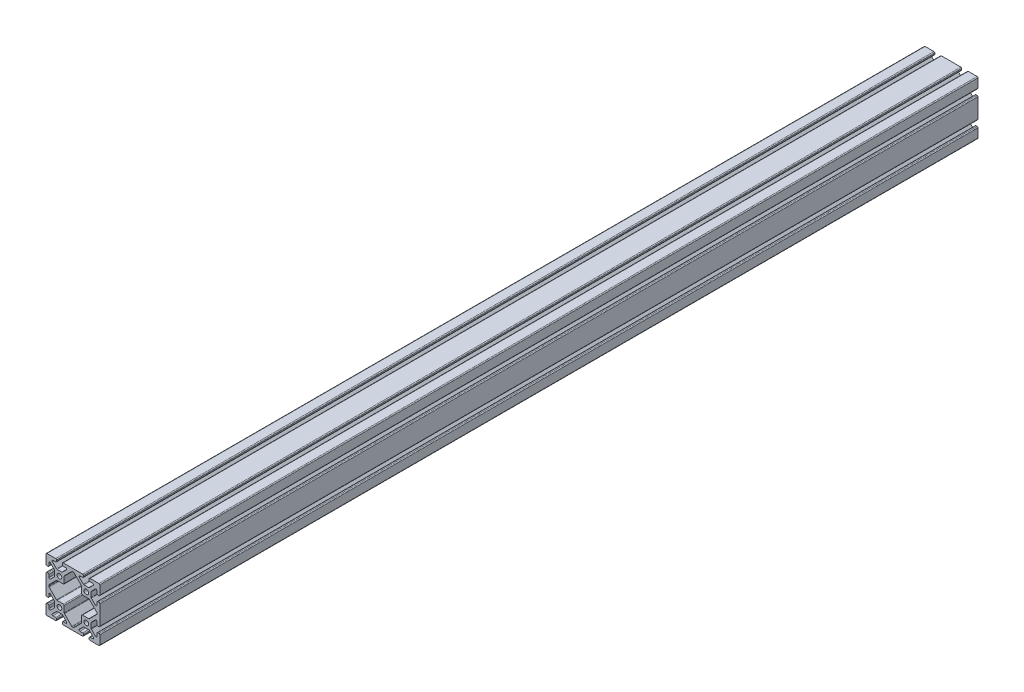
from build123d import *

# Parameters (mm, degrees)
SKETCH1_R           = 3.3274
BOSS_EXTRUDE1_DEPTH = 1244.6
FILLET1_R           = 1.27


with BuildPart() as part:
    # Sketch1 → Boss-Extrude1 (new body)
    with BuildSketch(Plane.XY):
        Polygon((-12.112318041, 14.986), (-3.882718041, 6.7564), (3.882718041, 6.7564), (12.112318041, 14.986), (4.064, 14.986), (4.064, 19.05), (19.05, 19.05), (19.05, 4.064), (14.986, 4.064), (14.986, 12.112318041), (6.7564, 3.882718041), (6.7564, -3.882718041), (14.986, -12.112318041), (14.986, -4.064), (19.05, -4.064), (19.05, -34.036), (14.986, -34.036), (14.986, -25.987681959), (6.7564, -34.217281959), (6.7564, -41.982718041), (14.986, -50.212318041), (14.986, -42.164), (19.05, -42.164), (19.05, -57.15), (4.064, -57.15), (4.064, -53.086), (12.112318041, -53.086), (3.882718041, -44.8564), (-3.882718041, -44.8564), (-12.112318041, -53.086), (-4.064, -53.086), (-4.064, -57.15), (-34.036, -57.15), (-34.036, -53.086), (-25.987681959, -53.086), (-34.217281959, -44.8564), (-41.982718041, -44.8564), (-50.212318041, -53.086), (-42.164, -53.086), (-42.164, -57.15), (-57.15, -57.15), (-57.15, -42.164), (-53.086, -42.164), (-53.086, -50.212318041), (-44.8564, -41.982718041), (-44.8564, -34.217281959), (-53.086, -25.987681959), (-53.086, -34.036), (-57.15, -34.036), (-57.15, -4.064), (-53.086, -4.064), (-53.086, -12.112318041), (-44.8564, -3.882718041), (-44.8564, 3.882718041), (-53.086, 12.112318041), (-53.086, 4.064), (-57.15, 4.064), (-57.15, 19.05), (-42.164, 19.05), (-42.164, 14.986), (-50.212318041, 14.986), (-41.982718041, 6.7564), (-34.217281959, 6.7564), (-25.987681959, 14.986), (-34.036, 14.986), (-34.036, 19.05), (-4.064, 19.05), (-4.064, 14.986), align=None)
        Circle(SKETCH1_R, mode=Mode.SUBTRACT)
        with Locations(Location((0, -38.1, 0), (0, 0, 180))):
            Circle(SKETCH1_R, mode=Mode.SUBTRACT)
        with Locations((-38.1, -38.1)):
            Circle(SKETCH1_R, mode=Mode.SUBTRACT)
        with Locations(Location((-38.1, 0, 0), (0, 0, 180))):
            Circle(SKETCH1_R, mode=Mode.SUBTRACT)
        Polygon((-6.7564, 3.882718041), (-6.7564, -6.7564), (3.882718041, -6.7564), (14.986, -17.859681959), (14.986, -20.240318041), (3.882718041, -31.3436), (-6.7564, -31.3436), (-6.7564, -41.982718041), (-17.859681959, -53.086), (-20.240318041, -53.086), (-31.3436, -41.982718041), (-31.3436, -31.3436), (-41.982718041, -31.3436), (-53.086, -20.240318041), (-53.086, -17.859681959), (-41.982718041, -6.7564), (-31.3436, -6.7564), (-31.3436, 3.882718041), (-20.240318041, 14.986), (-17.859681959, 14.986), align=None, mode=Mode.SUBTRACT)
    extrude(amount=BOSS_EXTRUDE1_DEPTH)

    # Fillet1
    fillet1_edges = [part.edges().sort_by_distance(p)[0] for p in [
        (19.05, 19.05, 622.3),
        (19.05, 4.064, 622.3),
        (14.986, 4.064, 622.3),
        (14.986, 12.112318041, 622.3),
        (6.7564, 3.882718041, 622.3),
        (6.7564, -3.882718041, 622.3),
        (14.986, -12.112318041, 622.3),
        (14.986, -4.064, 622.3),
        (19.05, -4.064, 622.3),
        (19.05, -34.036, 622.3),
        (14.986, -34.036, 622.3),
        (14.986, -25.987681959, 622.3),
        (6.7564, -34.217281959, 622.3),
        (6.7564, -41.982718041, 622.3),
        (14.986, -50.212318041, 622.3),
        (14.986, -42.164, 622.3),
        (19.05, -42.164, 622.3),
        (19.05, -57.15, 622.3),
        (4.064, -57.15, 622.3),
        (4.064, -53.086, 622.3),
        (12.112318041, -53.086, 622.3),
        (3.882718041, -44.8564, 622.3),
        (-3.882718041, -44.8564, 622.3),
        (-12.112318041, -53.086, 622.3),
        (-4.064, -53.086, 622.3),
        (-4.064, -57.15, 622.3),
        (-34.036, -57.15, 622.3),
        (-34.036, -53.086, 622.3),
        (-25.987681959, -53.086, 622.3),
        (-34.217281959, -44.8564, 622.3),
        (-41.982718041, -44.8564, 622.3),
        (-50.212318041, -53.086, 622.3),
        (-42.164, -53.086, 622.3),
        (-42.164, -57.15, 622.3),
        (-57.15, -57.15, 622.3),
        (-57.15, -42.164, 622.3),
        (-53.086, -42.164, 622.3),
        (-53.086, -50.212318041, 622.3),
        (-44.8564, -41.982718041, 622.3),
        (-44.8564, -34.217281959, 622.3),
        (-53.086, -25.987681959, 622.3),
        (-53.086, -34.036, 622.3),
        (-57.15, -34.036, 622.3),
        (-57.15, -4.064, 622.3),
        (-53.086, -4.064, 622.3),
        (-53.086, -12.112318041, 622.3),
        (-44.8564, -3.882718041, 622.3),
        (-44.8564, 3.882718041, 622.3),
        (-53.086, 12.112318041, 622.3),
        (-53.086, 4.064, 622.3),
        (-57.15, 4.064, 622.3),
        (-57.15, 19.05, 622.3),
        (-42.164, 19.05, 622.3),
        (-42.164, 14.986, 622.3),
        (-50.212318041, 14.986, 622.3),
        (-41.982718041, 6.7564, 622.3),
        (-34.217281959, 6.7564, 622.3),
        (-25.987681959, 14.986, 622.3),
        (-34.036, 14.986, 622.3),
        (-34.036, 19.05, 622.3),
        (-4.064, 19.05, 622.3),
        (-4.064, 14.986, 622.3),
        (-12.112318041, 14.986, 622.3),
        (-3.882718041, 6.7564, 622.3),
        (3.882718041, 6.7564, 622.3),
        (12.112318041, 14.986, 622.3),
        (4.064, 14.986, 622.3),
        (4.064, 19.05, 622.3),
        (3.882718041, -6.7564, 622.3),
        (-6.7564, -6.7564, 622.3),
        (-6.7564, 3.882718041, 622.3),
        (-17.859681959, 14.986, 622.3),
        (-20.240318041, 14.986, 622.3),
        (-31.3436, 3.882718041, 622.3),
        (-31.3436, -6.7564, 622.3),
        (-41.982718041, -6.7564, 622.3),
        (-53.086, -17.859681959, 622.3),
        (-53.086, -20.240318041, 622.3),
        (-41.982718041, -31.3436, 622.3),
        (-31.3436, -31.3436, 622.3),
        (-31.3436, -41.982718041, 622.3),
        (-20.240318041, -53.086, 622.3),
        (-17.859681959, -53.086, 622.3),
        (-6.7564, -31.3436, 622.3),
        (3.882718041, -31.3436, 622.3),
        (14.986, -20.240318041, 622.3),
        (14.986, -17.859681959, 622.3),
    ]]
    fillet(fillet1_edges, radius=FILLET1_R)


solid = part.part
